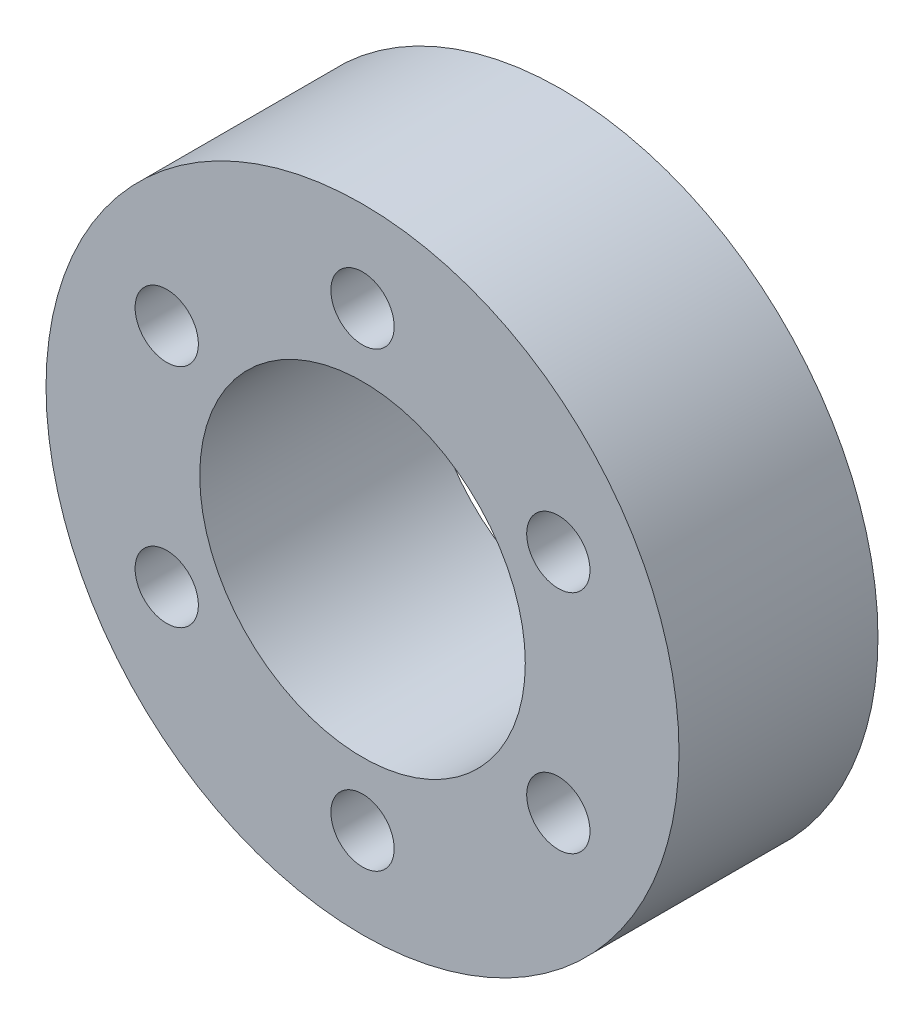
from build123d import *

# Parameters (mm, degrees)
SKETCH_1_R          = 14.5
EXTRUDE_1_DEPTH     = 1.5
SKETCH_2_R          = 17.5
EXTRUDE_2_DEPTH     = 11
SKETCH_3_R          = 1.75
SKETCH_3_R_2        = 9
CUT_EXTRUDE_1_DEPTH = 26.5


with BuildPart() as part:
    # 草图1 → 凸台-拉伸1 (new body)
    with BuildSketch(Plane.XY):
        Circle(SKETCH_1_R)
    extrude(amount=EXTRUDE_1_DEPTH)

    # 草图2 → 凸台-拉伸2 (add)
    with BuildSketch(Plane.XY.offset(1.5)):
        Circle(SKETCH_2_R)
    extrude(amount=EXTRUDE_2_DEPTH)

    # 草图3 → 切除-拉伸1 (cut)
    with BuildSketch(Plane(origin=(0, 0, 0), x_dir=(-1, 0, 0), z_dir=(0, 0, -1))):
        with Locations((0, 12.5)):
            Circle(SKETCH_3_R)
        Circle(SKETCH_3_R_2)
        with Locations((10.825317547, 6.25)):
            Circle(SKETCH_3_R)
        with Locations((10.825317547, -6.25)):
            Circle(SKETCH_3_R)
        with Locations((0, -12.5)):
            Circle(SKETCH_3_R)
        with Locations((-10.825317547, -6.25)):
            Circle(SKETCH_3_R)
        with Locations((-10.825317547, 6.25)):
            Circle(SKETCH_3_R)
    extrude(amount=-CUT_EXTRUDE_1_DEPTH, mode=Mode.SUBTRACT)


solid = part.part
